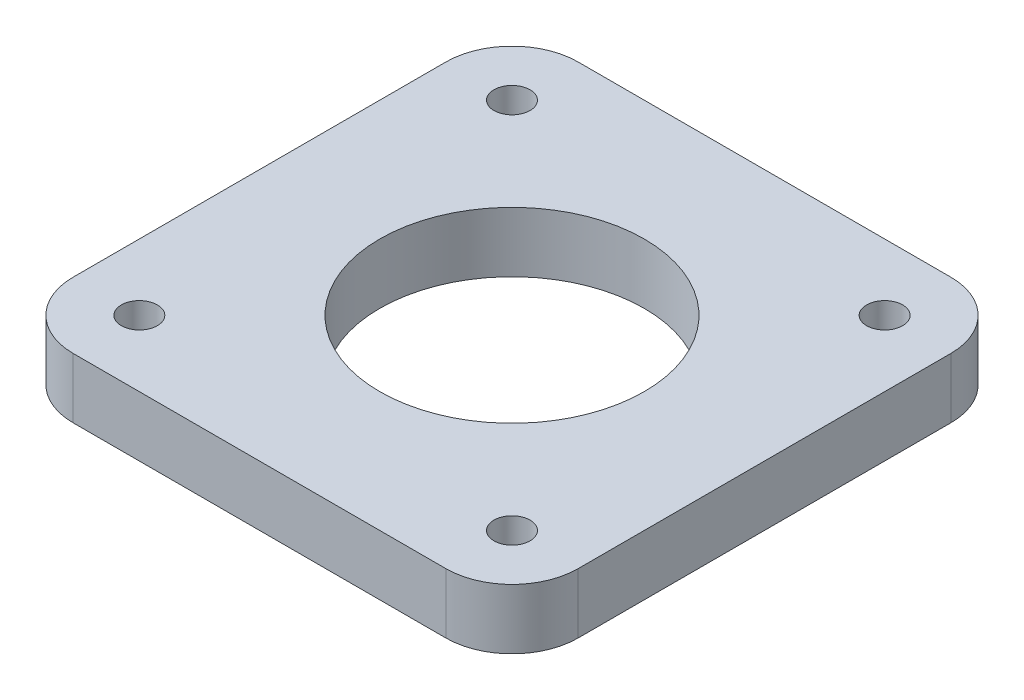
from build123d import *

# Parameters (mm, degrees)
SKETCH_1_R      = 1.5
SKETCH_1_R_2    = 11
EXTRUDE_1_DEPTH = 5


with BuildPart() as part:
    # 草圖1 → 填料-伸長1 (new body)
    with BuildSketch(Plane(origin=(0, 0, 0), x_dir=(1, 0, 0), z_dir=(0, 1, 0))):
        with BuildLine():
            Line((-15.5, 12.452631579), (15.5, 12.452631579))
            ThreePointArc((15.5, 12.452631579), (19.389087297, 10.841718875), (21, 6.952631579))
            Line((21, 6.952631579), (21, -24.047368421))
            ThreePointArc((21, -24.047368421), (19.389087297, -27.936455718), (15.5, -29.547368421))
            Line((15.5, -29.547368421), (-15.5, -29.547368421))
            ThreePointArc((-15.5, -29.547368421), (-19.389087297, -27.936455718), (-21, -24.047368421))
            Line((-21, -24.047368421), (-21, 6.952631579))
            ThreePointArc((-21, 6.952631579), (-19.389087297, 10.841718875), (-15.5, 12.452631579))
        make_face()
        with Locations(Location((15.5, 6.952631579, 0), (0, 0, 270))):
            Circle(SKETCH_1_R, mode=Mode.SUBTRACT)
        with Locations(Location((15.5, -24.047368421, 0), (0, 0, 90))):
            Circle(SKETCH_1_R, mode=Mode.SUBTRACT)
        with Locations(Location((-15.5, 6.952631579, 0), (0, 0, 90))):
            Circle(SKETCH_1_R, mode=Mode.SUBTRACT)
        with Locations(Location((-15.5, -24.047368421, 0), (0, 0, 270))):
            Circle(SKETCH_1_R, mode=Mode.SUBTRACT)
        with Locations(Location((0, -8.547368421, 0), (0, 0, 270))):
            Circle(SKETCH_1_R_2, mode=Mode.SUBTRACT)
    extrude(amount=EXTRUDE_1_DEPTH)


solid = part.part
